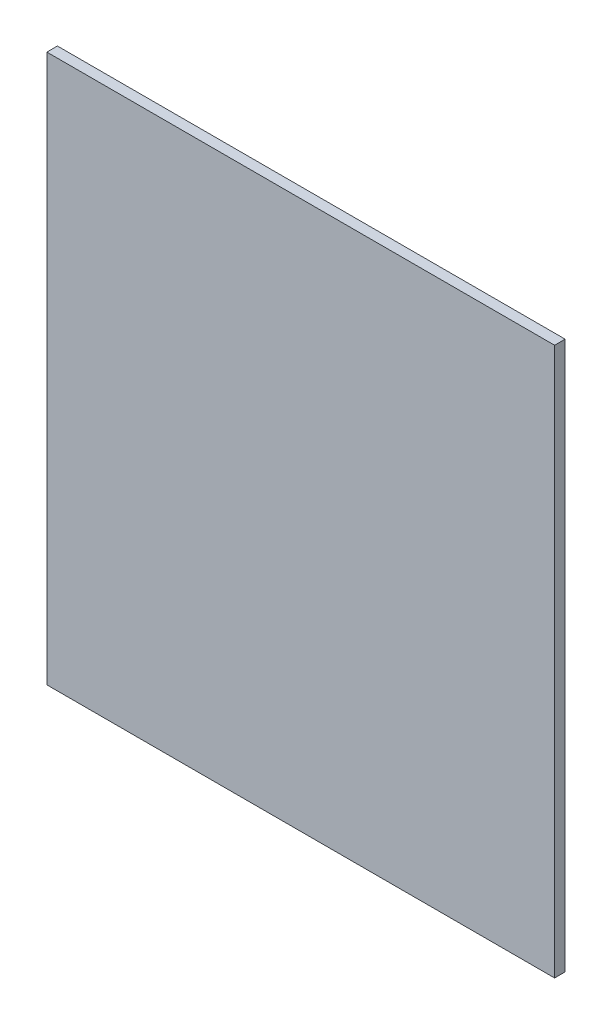
from build123d import *

# Parameters (mm, degrees)
SKETCH1_W           = 48.18
SKETCH1_H           = 52
BOSS_EXTRUDE1_DEPTH = 1


with BuildPart() as part:
    # Sketch1 → Boss-Extrude1 (new body)
    with BuildSketch(Plane.XY):
        Rectangle(SKETCH1_W, SKETCH1_H)
    extrude(amount=BOSS_EXTRUDE1_DEPTH)


solid = part.part
